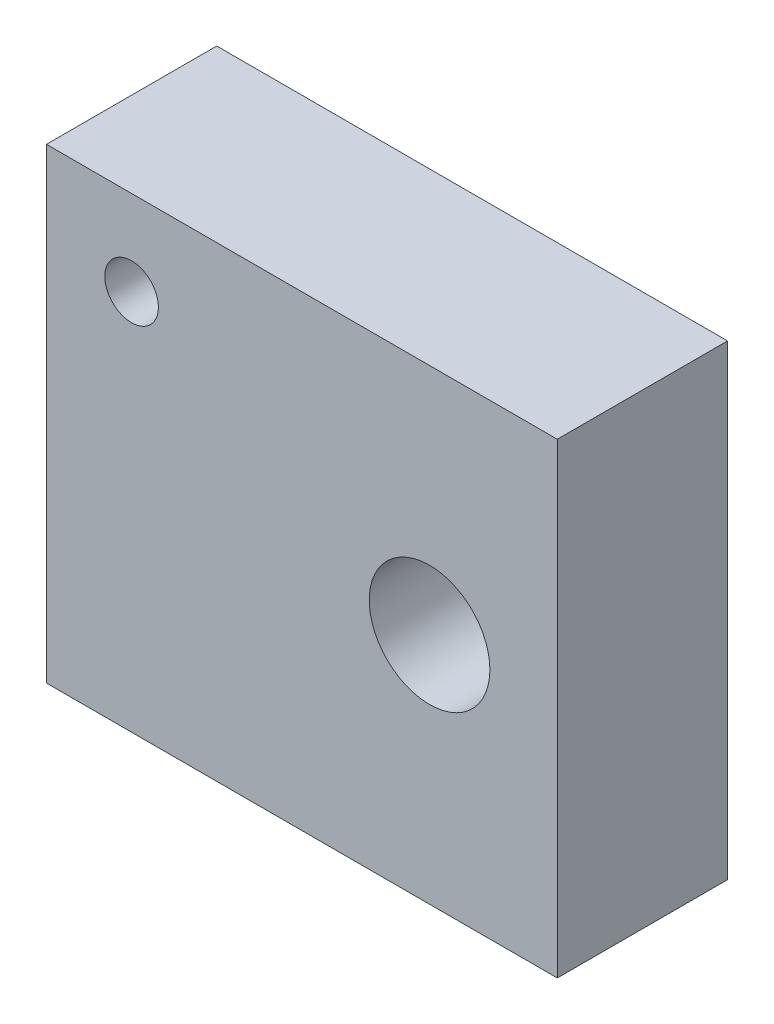
from build123d import *

# Parameters (mm, degrees)
SKETCH1_W                = 19.05
SKETCH1_H                = 17.4
BOSS_EXTRUDE1_DEPTH      = 6.35
M4_CLEARANCE_HOLE1_D     = 4.5
M4_CLEARANCE_HOLE1_DEPTH = 12.7
M4_CLEARANCE_HOLE1_TIP   = 1.351936393
SKETCH4_R                = 1
CUT_EXTRUDE1_DEPTH       = 27.570378243


with BuildPart() as part:
    # Sketch1 → Boss-Extrude1 (new body)
    with BuildSketch(Plane.XY):
        with Locations((9.525, 8.7)):
            Rectangle(SKETCH1_W, SKETCH1_H)
    extrude(amount=BOSS_EXTRUDE1_DEPTH)

    # M4 Clearance Hole1
    with Locations(Plane.XY.offset(6.35)):
        with Locations((14.2875, 8.7)):
            Hole(M4_CLEARANCE_HOLE1_D / 2, depth=M4_CLEARANCE_HOLE1_DEPTH)
            with Locations((0, 0, -(M4_CLEARANCE_HOLE1_DEPTH + M4_CLEARANCE_HOLE1_TIP / 2))):  # 118° drill point
                Cone(0, M4_CLEARANCE_HOLE1_D / 2, M4_CLEARANCE_HOLE1_TIP, mode=Mode.SUBTRACT)

    # Sketch4 → Cut-Extrude1 (cut, through all)
    with BuildSketch(Plane.XY.offset(6.35)):
        with Locations((3.175, 14.225)):
            Circle(SKETCH4_R)
    extrude(amount=-CUT_EXTRUDE1_DEPTH, mode=Mode.SUBTRACT)


solid = part.part
